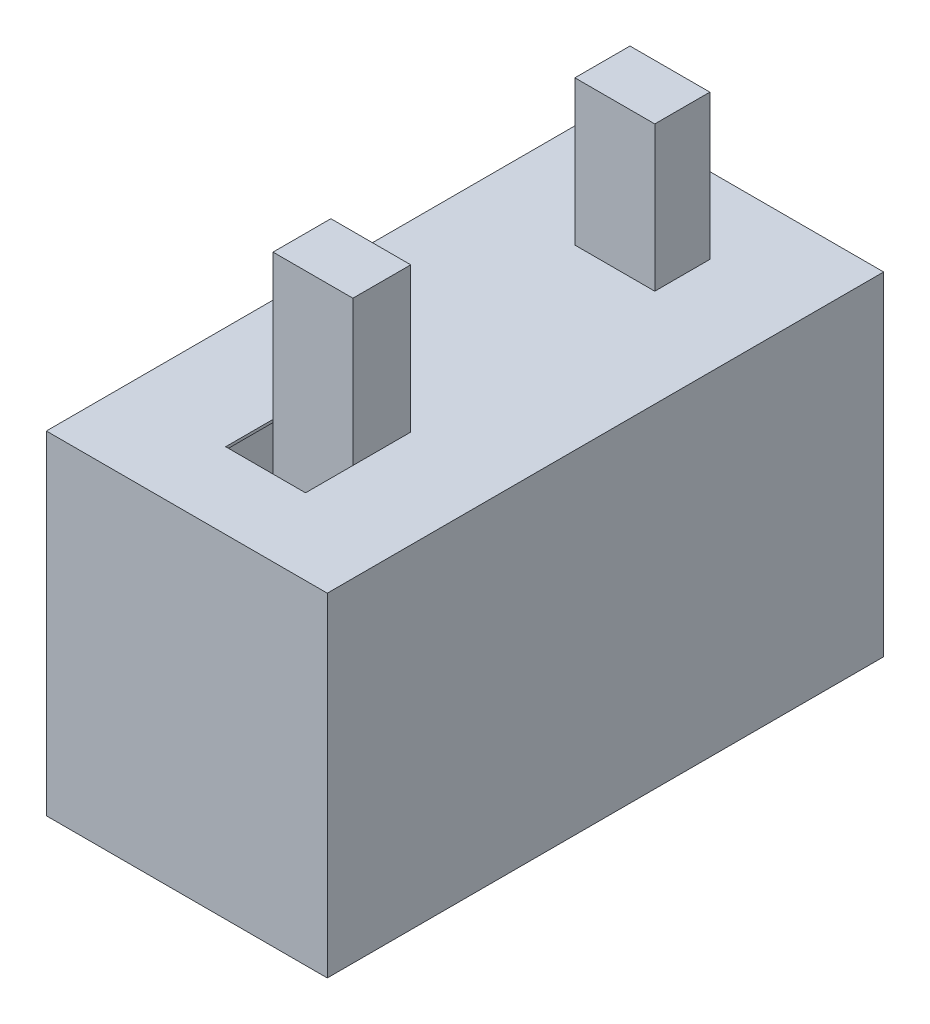
from build123d import *

# Parameters (mm, degrees)
ESQUISSE2_W             = 510
ESQUISSE2_H             = 1010
BOSS_EXTRU_1_DEPTH      = 5
ESQUISSE4_W             = 510
ESQUISSE4_H             = 1010
ESQUISSE4_W_2           = 500
ESQUISSE4_H_2           = 1000
BOSS_EXTRU_2_DEPTH      = 595
ESQUISSE5_W             = 510
ESQUISSE5_H             = 1010
BOSS_EXTRU_3_DEPTH      = 5
ESQUISSE6_W             = 145
ESQUISSE6_H             = 191
ESQUISSE6_H_2           = 100
ENL_V_MAT_EXTRU_1_DEPTH = 10
ESQUISSE8_W             = 145
ESQUISSE8_H             = 100
ESQUISSE8_H_2           = 105
BOSS_EXTRU_5_DEPTH      = 863


with BuildPart() as part:
    # Esquisse2 → Boss.-Extru.1 (new body)
    with BuildSketch(Plane(origin=(0, 0, 0), x_dir=(1, 0, 0), z_dir=(0, 1, 0))):
        with Locations((199.263257584, -405.525758022)):
            Rectangle(ESQUISSE2_W, ESQUISSE2_H)
    extrude(amount=BOSS_EXTRU_1_DEPTH)

    # Esquisse4 → Boss.-Extru.2 (add)
    with BuildSketch(Plane(origin=(0, 5, 0), x_dir=(1, 0, 0), z_dir=(0, 1, 0))):
        with Locations((199.263257584, -405.525758022)):
            Rectangle(ESQUISSE4_W, ESQUISSE4_H)
        with Locations((199.263257584, -405.525758022)):
            Rectangle(ESQUISSE4_W_2, ESQUISSE4_H_2, mode=Mode.SUBTRACT)
    extrude(amount=BOSS_EXTRU_2_DEPTH)

    # Esquisse5 → Boss.-Extru.3 (add)
    with BuildSketch(Plane(origin=(0, 600, 0), x_dir=(1, 0, 0), z_dir=(0, 1, 0))):
        with Locations((199.263257584, -405.525758022)):
            Rectangle(ESQUISSE5_W, ESQUISSE5_H)
    extrude(amount=BOSS_EXTRU_3_DEPTH)

    # Esquisse6 → Enlèv. mat.-Extru.1 (cut)
    with BuildSketch(Plane(origin=(0, 605, 0), x_dir=(1, 0, 0), z_dir=(0, 1, 0))):
        with Locations((204.263257584, -677.025758022)):
            Rectangle(ESQUISSE6_W, ESQUISSE6_H)
        with Locations((204.263257584, -88.525758022)):
            Rectangle(ESQUISSE6_W, ESQUISSE6_H_2)
    extrude(amount=-ENL_V_MAT_EXTRU_1_DEPTH, mode=Mode.SUBTRACT)

    # Esquisse8 → Boss.-Extru.5 (add)
    with BuildSketch(Plane(origin=(0, 5, 0), x_dir=(1, 0, 0), z_dir=(0, 1, 0))):
        with Locations((204.263257584, -88.525758022)):
            Rectangle(ESQUISSE8_W, ESQUISSE8_H)
        with Locations((204.263257584, -634.025758022)):
            Rectangle(ESQUISSE8_W, ESQUISSE8_H_2)
    extrude(amount=BOSS_EXTRU_5_DEPTH)


solid = part.part
